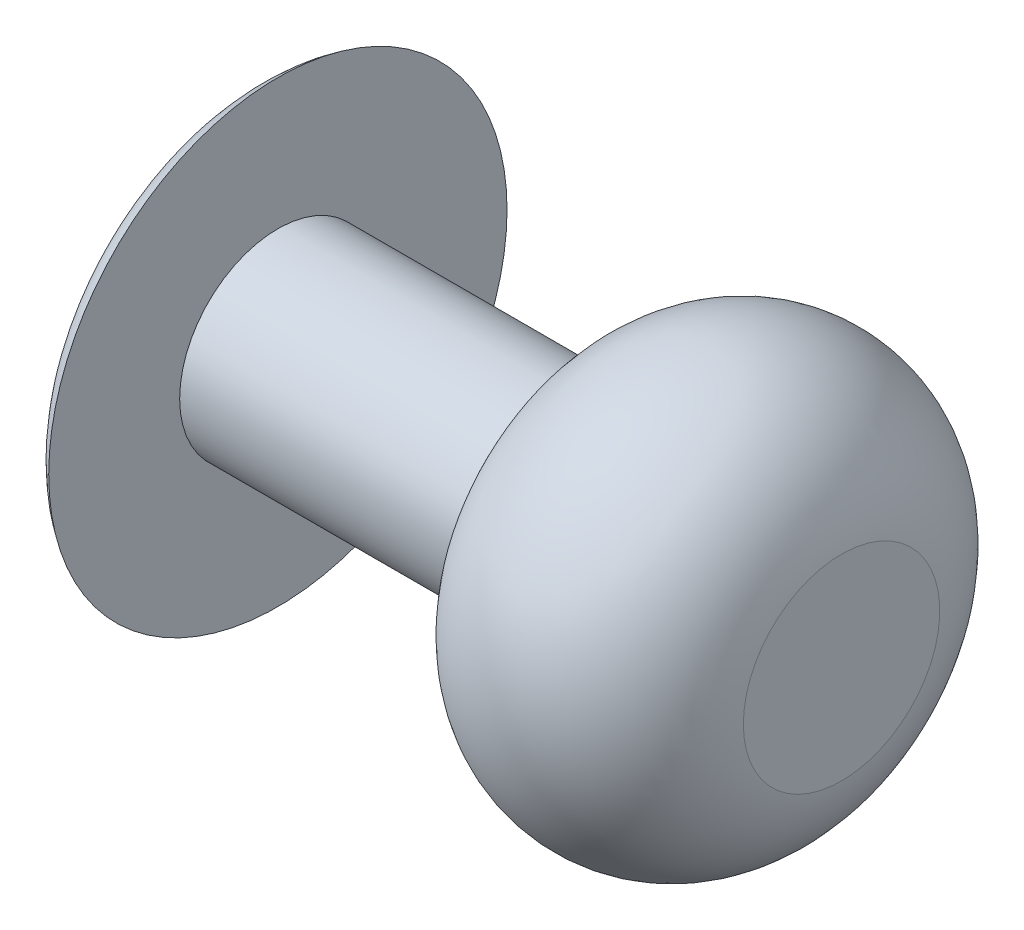
from build123d import *

# Parameters (mm, degrees)
ESQUISSE2_R      = 1
EXTRUSION1_DEPTH = 4


with BuildPart() as part:
    # Esquisse1 → Révolution1 (revolve)
    with BuildSketch(Plane.XY, mode=Mode.PRIVATE) as r_volution1_sk:
        with BuildLine():
            Line((-13.490599357, 0), (-13.490599357, 2.5))
            ThreePointArc((-13.490599357, 2.5), (-13.343527434, 3.071044042), (-12.938906334, 3.5))
            Line((-12.938906334, 3.5), (-12.938906334, 1.5))
            Line((-12.938906334, 1.5), (-8.438906334, 1.5))
            ThreePointArc((-8.438906334, 1.5), (-6.384495581, 3.280449293), (-4.330084828, 1.5))
            Line((-4.330084828, 1.5), (-4.330084828, 0))
            Line((-4.330084828, 0), (-13.490599357, 0))
        make_face()
    revolve(r_volution1_sk.sketch.rotate(Axis((-91.106565723, 0, 0), (1, 0, 0)), 90), axis=Axis((-91.106565723, 0, 0), (1, 0, 0)))

    # Esquisse2 → Extrusion1 (cut)
    with BuildSketch(Plane.ZY.offset(13.490599357)):
        Circle(ESQUISSE2_R)
    extrude(amount=-EXTRUSION1_DEPTH, mode=Mode.SUBTRACT)


solid = part.part
